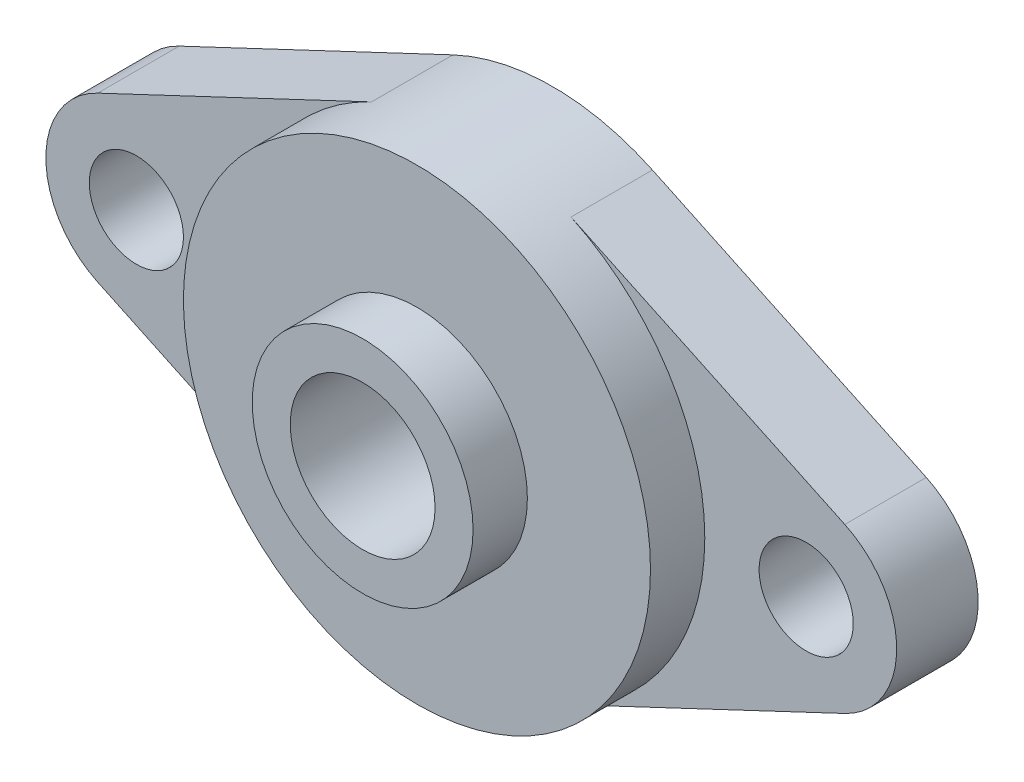
from build123d import *
from build123d.topology import SkipClean

# Parameters (mm, degrees)
SKETCH_1_R          = 2.6
EXTRUDE_1_DEPTH     = 4.5
EXTRUDE_START       = 4.5
SKETCH_2_R          = 12.9
EXTRUDE_2_DEPTH     = 3
EXTRUDE_START_2     = 7.5
SKETCH_4_R          = 6.1
EXTRUDE_3_DEPTH     = 3
SKETCH_6_R          = 4
CUT_EXTRUDE_1_DEPTH = 10.5


with BuildPart() as part:
    # 草图1 → 凸台-拉伸1 (new body)
    with BuildSketch(Plane.XY):
        with BuildLine():
            Line((-20.635135135, 4.521194306), (-5.508648649, 11.66468131))
            ThreePointArc((-5.508648649, 11.66468131), (0, 12.9), (5.508648649, 11.66468131))
            Line((5.508648649, 11.66468131), (20.635135135, 4.521194306))
            ThreePointArc((20.635135135, 4.521194306), (23.5, 0), (20.635135135, -4.521194306))
            Line((20.635135135, -4.521194306), (5.508648649, -11.66468131))
            ThreePointArc((5.508648649, -11.66468131), (0, -12.9), (-5.508648649, -11.66468131))
            Line((-5.508648649, -11.66468131), (-20.635135135, -4.521194306))
            ThreePointArc((-20.635135135, -4.521194306), (-23.5, 0), (-20.635135135, 4.521194306))
        make_face()
        with Locations((18.5, 0)):
            Circle(SKETCH_1_R, mode=Mode.SUBTRACT)
        with Locations((-18.5, 0)):
            Circle(SKETCH_1_R, mode=Mode.SUBTRACT)
    extrude(amount=EXTRUDE_1_DEPTH)

    # 草图2 → 凸台-拉伸2 (add)
    with SkipClean():  # the faces are left unmerged after this step: merging them gives an invalid solid
        with BuildSketch(Plane.XY.offset(EXTRUDE_START)):
            with Locations(Location((0, 0, 0), (0, 0, 115.279035224))):
                Circle(SKETCH_2_R)
        extrude(amount=EXTRUDE_2_DEPTH)

    # 草图4 → 凸台-拉伸3 (add)
    with SkipClean():  # the faces are left unmerged after this step: merging them gives an invalid solid
        with BuildSketch(Plane.XY.offset(EXTRUDE_START_2)):
            Circle(SKETCH_4_R)
        extrude(amount=EXTRUDE_3_DEPTH)

    # 草图6 → 切除-拉伸1 (cut)
    with SkipClean():  # the faces are left unmerged after this step: merging them gives an invalid solid
        with BuildSketch(Plane.XY):
            Circle(SKETCH_6_R)
        extrude(amount=CUT_EXTRUDE_1_DEPTH, mode=Mode.SUBTRACT)


solid = part.part
